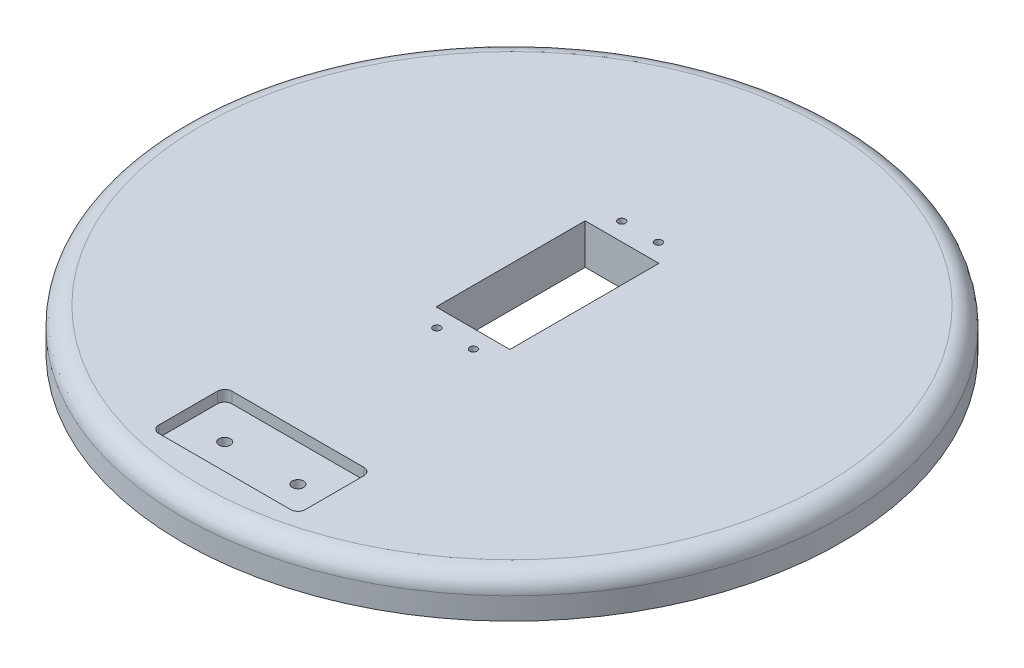
from build123d import *

# Parameters (mm, degrees)
SKETCH1_R           = 90
BOSS_EXTRUDE1_DEPTH = 11
SKETCH7_W           = 40
SKETCH7_H           = 20
CUT_EXTRUDE7_DEPTH  = 3
SKETCH12_R          = 1.55
CUT_EXTRUDE8_DEPTH  = 20
SKETCH13_R          = 3
CUT_EXTRUDE9_DEPTH  = 3
FILLET1_R           = 2
FILLET2_R           = 2
FILLET3_R           = 2
FILLET4_R           = 2
SKETCH15_R          = 85.2
SKETCH15_R_2        = 75.2
CUT_EXTRUDE10_DEPTH = 6
FILLET5_R           = 5
SKETCH16_W          = 20.139846291
SKETCH16_H          = 40.720332108
CUT_EXTRUDE13_DEPTH = 20
SKETCH17_R          = 1
CUT_EXTRUDE14_DEPTH = 10


with BuildPart() as part:
    # Sketch1 → Boss-Extrude1 (new body)
    with BuildSketch(Plane(origin=(0, 0, 0), x_dir=(1, 0, 0), z_dir=(0, 1, 0))):
        with Locations(Location((0, 0, 0), (0, 0, 270))):
            Circle(SKETCH1_R)
    extrude(amount=BOSS_EXTRUDE1_DEPTH)

    # Sketch7 → Cut-Extrude7 (cut)
    with BuildSketch(Plane(origin=(0, 11, 0), x_dir=(1, 0, 0), z_dir=(0, 1, 0))):
        with Locations((0, -68.46128741)):
            Rectangle(SKETCH7_W, SKETCH7_H)
    extrude(amount=-CUT_EXTRUDE7_DEPTH, mode=Mode.SUBTRACT)

    # Sketch12 → Cut-Extrude8 (cut)
    with BuildSketch(Plane(origin=(0, 8, 0), x_dir=(1, 0, 0), z_dir=(0, 1, 0))):
        with Locations(Location((10, -68.46128741, 0), (0, 0, 270))):
            Circle(SKETCH12_R)
        with Locations(Location((-10, -68.46128741, 0), (0, 0, 270))):
            Circle(SKETCH12_R)
    extrude(amount=-CUT_EXTRUDE8_DEPTH, mode=Mode.SUBTRACT)

    # Sketch13 → Cut-Extrude9 (cut)
    with BuildSketch(Plane.XZ):
        with Locations(Location((10, 68.46128741, 0), (0, 0, 270))):
            Circle(SKETCH13_R)
        with Locations(Location((-10, 68.46128741, 0), (0, 0, 270))):
            Circle(SKETCH13_R)
    extrude(amount=-CUT_EXTRUDE9_DEPTH, mode=Mode.SUBTRACT)

    # Fillet1
    fillet1_edges = [part.edges().sort_by_distance(p)[0] for p in [
        (-20, 9.5, 58.46128741),
    ]]
    fillet(fillet1_edges, radius=FILLET1_R)

    # Fillet2
    fillet2_edges = [part.edges().sort_by_distance(p)[0] for p in [
        (20, 9.5, 58.46128741),
    ]]
    fillet(fillet2_edges, radius=FILLET2_R)

    # Fillet3
    fillet3_edges = [part.edges().sort_by_distance(p)[0] for p in [
        (-20, 9.5, 78.46128741),
    ]]
    fillet(fillet3_edges, radius=FILLET3_R)

    # Fillet4
    fillet4_edges = [part.edges().sort_by_distance(p)[0] for p in [
        (20, 9.5, 78.46128741),
    ]]
    fillet(fillet4_edges, radius=FILLET4_R)

    # Sketch15 → Cut-Extrude10 (cut)
    with BuildSketch(Plane.XZ):
        with Locations(Location((0, 0, 0), (0, 0, 270))):
            Circle(SKETCH15_R)
        with Locations(Location((0, 0, 0), (0, 0, 270))):
            Circle(SKETCH15_R_2, mode=Mode.SUBTRACT)
    extrude(amount=-CUT_EXTRUDE10_DEPTH, mode=Mode.SUBTRACT)

    # Fillet5
    fillet5_edges = [part.edges().sort_by_distance(p)[0] for p in [
        (0, 11, -90),
    ]]
    fillet(fillet5_edges, radius=FILLET5_R)

    # Sketch16 → Cut-Extrude13 (cut)
    with BuildSketch(Plane(origin=(0, 11, 0), x_dir=(1, 0, 0), z_dir=(0, 1, 0))):
        with Locations((0.000598288, 9.704977579)):
            Rectangle(SKETCH16_W, SKETCH16_H)
    extrude(amount=-CUT_EXTRUDE13_DEPTH, mode=Mode.SUBTRACT)

    # Sketch17 → Cut-Extrude14 (cut)
    with BuildSketch(Plane(origin=(0, 11, 0), x_dir=(1, 0, 0), z_dir=(0, 1, 0))):
        with Locations(Location((-5, 34.9655003, 0), (0, 0, 270))):
            Circle(SKETCH17_R)
        with Locations(Location((5, 34.9655003, 0), (0, 0, 270))):
            Circle(SKETCH17_R)
        with Locations(Location((-5, -15.5345003, 0), (0, 0, 270))):
            Circle(SKETCH17_R)
        with Locations(Location((5, -15.5345003, 0), (0, 0, 270))):
            Circle(SKETCH17_R)
    extrude(amount=-CUT_EXTRUDE14_DEPTH, mode=Mode.SUBTRACT)


solid = part.part
